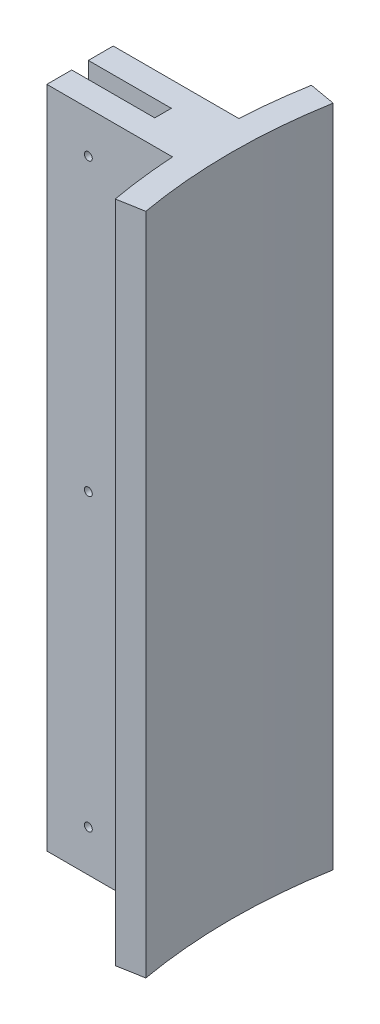
from build123d import *

# Parameters (mm, degrees)
BOSS_EXTRUDE1_DEPTH      = 80
M1_2X0_25_TAPPED_HOLE2_D = 0.95


with BuildPart() as part:
    # Sketch1 → Boss-Extrude1 (new body)
    with BuildSketch(Plane(origin=(0, 0, 0), x_dir=(1, 0, 0), z_dir=(0, 1, 0))):
        with BuildLine():
            Line((-64.012503946, -11.287131548), (-67.140480461, -11.838678203))
            ThreePointArc((-67.140480461, -11.838678203), (-67.722822081, -7.932947987), (-68.07746332, -4))
            Line((-68.07746332, -4), (-68.222773013, -4))
            Line((-68.222773013, -4), (-83.222773013, -4))
            Line((-83.222773013, -4), (-83.222773013, -1))
            Line((-83.222773013, -1), (-73.222773013, -1))
            Line((-73.222773013, -1), (-73.222773013, 1))
            Line((-73.222773013, 1), (-83.222773013, 1))
            Line((-83.222773013, 1), (-83.222773013, 4))
            Line((-83.222773013, 4), (-68.222773013, 4))
            Line((-68.222773013, 4), (-68.093710355, 4))
            ThreePointArc((-68.093710355, 4), (-67.754779073, 7.936674143), (-67.187770434, 11.847016701))
            Line((-67.187770434, 11.847016701), (-64.012503946, 11.287131548))
            ThreePointArc((-64.012503946, 11.287131548), (-65, 0), (-64.012503946, -11.287131548))
        make_face()
    extrude(amount=BOSS_EXTRUDE1_DEPTH)

    # M1.2x0.25 Tapped Hole2 (through all)
    with Locations(Plane.XY.offset(4)):
        with Locations((-78.222773013, 75), (-78.222773013, 40), (-78.222773013, 5)):
            Hole(M1_2X0_25_TAPPED_HOLE2_D / 2)


solid = part.part
